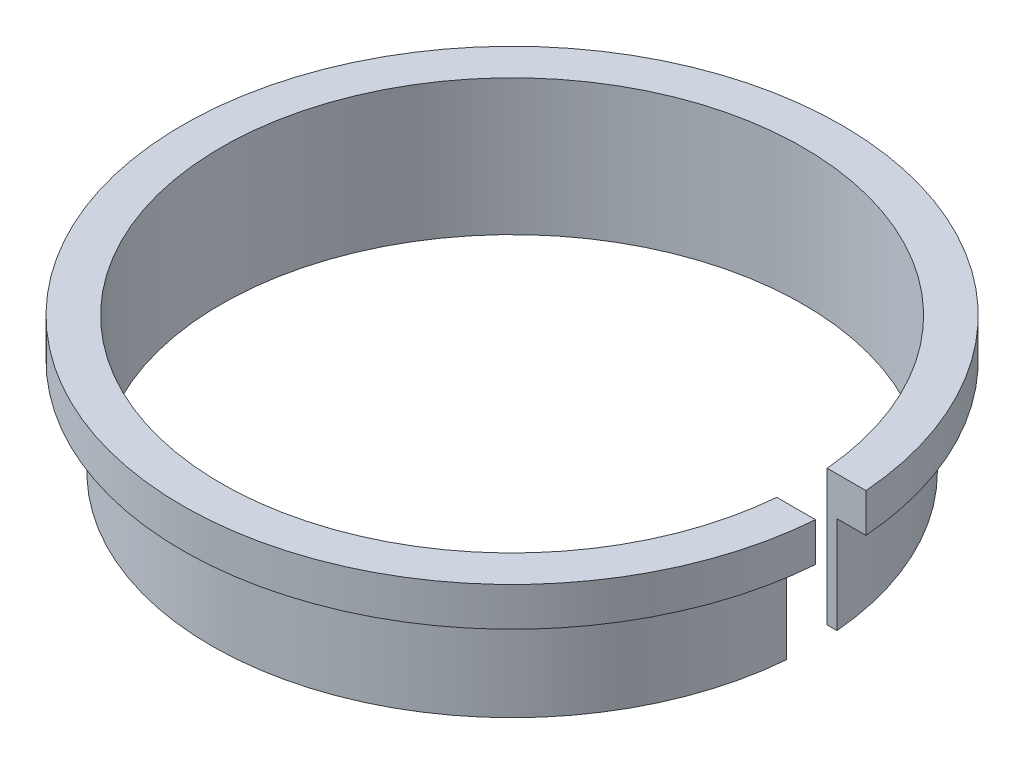
from build123d import *

# Parameters (mm, degrees)
SKETCH1_R           = 15.5
SKETCH1_R_2         = 15
BOSS_EXTRUDE1_DEPTH = 7
BOSS_EXTRUDE2_START = -2
SKETCH2_R           = 16.99
SKETCH2_R_2         = 15.5
BOSS_EXTRUDE2_DEPTH = 2
SKETCH3_W           = 2.598251864
SKETCH3_H           = 7
CUT_EXTRUDE1_DEPTH  = 10


with BuildPart() as part:
    # Sketch1 → Boss-Extrude1 (new body)
    with BuildSketch(Plane(origin=(0, 0, 0), x_dir=(1, 0, 0), z_dir=(0, 1, 0))):
        with Locations(Location((0, 0, 0), (0, 0, 270))):
            Circle(SKETCH1_R)
        with Locations(Location((0, 0, 0), (0, 0, 270))):
            Circle(SKETCH1_R_2, mode=Mode.SUBTRACT)
    extrude(amount=BOSS_EXTRUDE1_DEPTH)

    # Sketch2 → Boss-Extrude2 (add)
    with BuildSketch(Plane(origin=(0, 7, 0), x_dir=(1, 0, 0), z_dir=(0, 1, 0)).offset(BOSS_EXTRUDE2_START)):
        with Locations(Location((0, 0, 0), (0, 0, 270))):
            Circle(SKETCH2_R)
        with Locations(Location((0, 0, 0), (0, 0, 270))):
            Circle(SKETCH2_R_2, mode=Mode.SUBTRACT)
    extrude(amount=BOSS_EXTRUDE2_DEPTH)

    # Sketch3 → Cut-Extrude1 (cut)
    with BuildSketch(Plane(origin=(16.99, 0, 0), x_dir=(0, 0, -1), z_dir=(1, 0, 0))):
        with Locations((0, 3.5)):
            Rectangle(SKETCH3_W, SKETCH3_H)
    extrude(amount=-CUT_EXTRUDE1_DEPTH, mode=Mode.SUBTRACT)


solid = part.part
